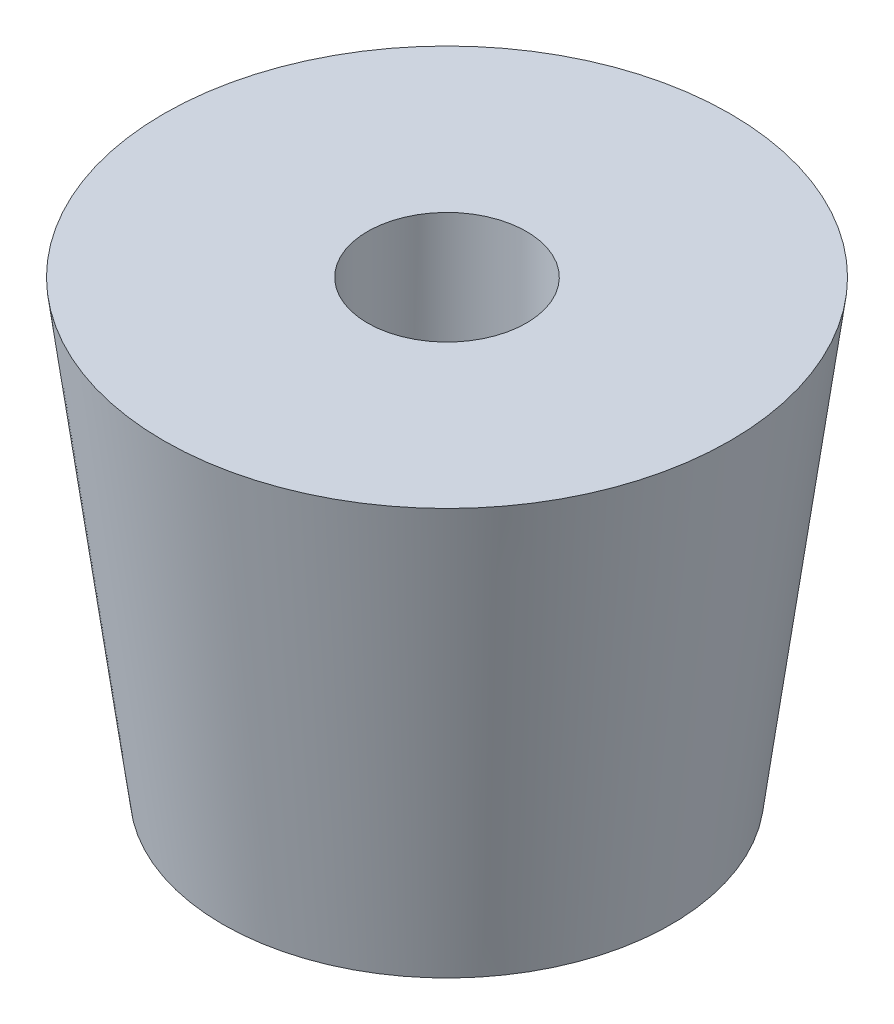
from build123d import *

# Parameters (mm, degrees)
SKETCH1_R           = 6.35
BOSS_EXTRUDE1_DEPTH = 12.7
BOSS_EXTRUDE1_DRAFT = -7.5
SKETCH2_R           = 3.5
CUT_EXTRUDE1_DEPTH  = 8.89
SKETCH3_R           = 2.25
CUT_EXTRUDE2_DEPTH  = 18.029226108


with BuildPart() as part:
    # Sketch1 → Boss-Extrude1 (with draft: the straight prism first)
    with BuildSketch(Plane(origin=(0, 0, 0), x_dir=(1, 0, 0), z_dir=(0, 1, 0))):
        Circle(SKETCH1_R)
    extrude(amount=BOSS_EXTRUDE1_DEPTH)
    # Boss-Extrude1: the draft: its side faces are tilted about the plane it starts from
    boss_extrude1_sides = [part.faces().sort_by_distance(p)[0] for p in [
        (-6.35, 6.35, 0),
    ]]
    draft(boss_extrude1_sides, Plane(origin=(0, 0, 0), x_dir=(1, 0, 0), z_dir=(0, 1, 0)), BOSS_EXTRUDE1_DRAFT)

    # Sketch2 → Cut-Extrude1 (cut)
    with BuildSketch(Plane.XZ):
        with Locations(Location((0, 0, 0), (0, 0, 270))):
            Circle(SKETCH2_R)
    extrude(amount=-CUT_EXTRUDE1_DEPTH, mode=Mode.SUBTRACT)

    # Sketch3 → Cut-Extrude2 (cut, through all)
    with BuildSketch(Plane(origin=(0, 12.7, 0), x_dir=(1, 0, 0), z_dir=(0, 1, 0))):
        with Locations(Location((0, 0, 0), (0, 0, 270))):
            Circle(SKETCH3_R)
    extrude(amount=-CUT_EXTRUDE2_DEPTH, mode=Mode.SUBTRACT)


solid = part.part
